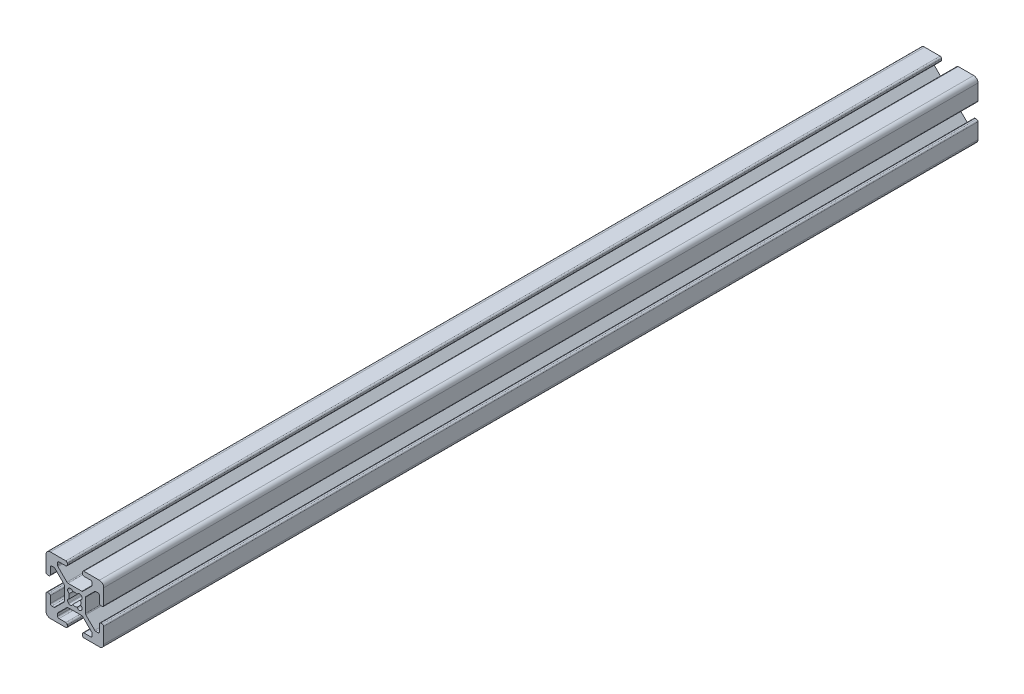
from build123d import *

# Parameters (mm, degrees)
EXTRUDE1_DEPTH = 303


with BuildPart() as part:
    # Sketch1 → Extrude1 (new body)
    with BuildSketch(Plane.XY):
        with BuildLine():
            Line((-5.032287798, -0.341059771), (-5.516287798, -0.341059771))
            ThreePointArc((-5.516287798, -0.341059771), (-5.875498042, -0.192270016), (-6.024287798, 0.166940229))
            Line((-6.024287798, 0.166940229), (-6.024287798, 2.515940229))
            ThreePointArc((-6.024287798, 2.515940229), (-6.173077553, 2.875150474), (-6.532287798, 3.023940229))
            Line((-6.532287798, 3.023940229), (-7.258207136, 3.023940229))
            ThreePointArc((-7.258207136, 3.023940229), (-7.45261032, 2.985271032), (-7.617417381, 2.875150474))
            Line((-7.617417381, 2.875150474), (-10.720498042, -0.227930187))
            ThreePointArc((-10.720498042, -0.227930187), (-10.8306186, -0.392737249), (-10.869287798, -0.587140432))
            Line((-10.869287798, -0.587140432), (-10.869287798, -5.354979109))
            ThreePointArc((-10.869287798, -5.354979109), (-10.8306186, -5.549382293), (-10.720498042, -5.714189354))
            Line((-10.720498042, -5.714189354), (-7.617417381, -8.817270016))
            ThreePointArc((-7.617417381, -8.817270016), (-7.45261032, -8.927390573), (-7.258207136, -8.966059771))
            Line((-7.258207136, -8.966059771), (-6.532287798, -8.966059771))
            ThreePointArc((-6.532287798, -8.966059771), (-6.173077553, -8.817270016), (-6.024287798, -8.458059771))
            Line((-6.024287798, -8.458059771), (-6.024287798, -6.109059771))
            ThreePointArc((-6.024287798, -6.109059771), (-5.875498042, -5.749849526), (-5.516287798, -5.601059771))
            Line((-5.516287798, -5.601059771), (-5.032287798, -5.601059771))
            ThreePointArc((-5.032287798, -5.601059771), (-4.673077553, -5.749849526), (-4.524287798, -6.109059771))
            Line((-4.524287798, -6.109059771), (-4.524287798, -11.471059771))
            ThreePointArc((-4.524287798, -11.471059771), (-4.963627626, -12.531719943), (-6.024287798, -12.971059771))
            Line((-6.024287798, -12.971059771), (-11.386287798, -12.971059771))
            ThreePointArc((-11.386287798, -12.971059771), (-11.745498042, -12.822270016), (-11.894287798, -12.463059771))
            Line((-11.894287798, -12.463059771), (-11.894287798, -11.979059771))
            ThreePointArc((-11.894287798, -11.979059771), (-11.745498042, -11.619849526), (-11.386287798, -11.471059771))
            Line((-11.386287798, -11.471059771), (-9.037287798, -11.471059771))
            ThreePointArc((-9.037287798, -11.471059771), (-8.678077553, -11.322270016), (-8.529287798, -10.963059771))
            Line((-8.529287798, -10.963059771), (-8.529287798, -10.237140432))
            ThreePointArc((-8.529287798, -10.237140432), (-8.567956995, -10.042737249), (-8.678077553, -9.877930187))
            Line((-8.678077553, -9.877930187), (-11.781158214, -6.774849526))
            ThreePointArc((-11.781158214, -6.774849526), (-11.945965275, -6.664728968), (-12.140368459, -6.626059771))
            Line((-12.140368459, -6.626059771), (-16.908207136, -6.626059771))
            ThreePointArc((-16.908207136, -6.626059771), (-17.10261032, -6.664728968), (-17.267417381, -6.774849526))
            Line((-17.267417381, -6.774849526), (-20.370498042, -9.877930187))
            ThreePointArc((-20.370498042, -9.877930187), (-20.4806186, -10.042737249), (-20.519287798, -10.237140432))
            Line((-20.519287798, -10.237140432), (-20.519287798, -10.963059771))
            ThreePointArc((-20.519287798, -10.963059771), (-20.370498042, -11.322270016), (-20.011287798, -11.471059771))
            Line((-20.011287798, -11.471059771), (-17.662287798, -11.471059771))
            ThreePointArc((-17.662287798, -11.471059771), (-17.303077553, -11.619849526), (-17.154287798, -11.979059771))
            Line((-17.154287798, -11.979059771), (-17.154287798, -12.463059771))
            ThreePointArc((-17.154287798, -12.463059771), (-17.303077553, -12.822270016), (-17.662287798, -12.971059771))
            Line((-17.662287798, -12.971059771), (-23.024287798, -12.971059771))
            ThreePointArc((-23.024287798, -12.971059771), (-24.084947969, -12.531719943), (-24.524287798, -11.471059771))
            Line((-24.524287798, -11.471059771), (-24.524287798, -6.109059771))
            ThreePointArc((-24.524287798, -6.109059771), (-24.375498042, -5.749849526), (-24.016287798, -5.601059771))
            Line((-24.016287798, -5.601059771), (-23.532287798, -5.601059771))
            ThreePointArc((-23.532287798, -5.601059771), (-23.173077553, -5.749849526), (-23.024287798, -6.109059771))
            Line((-23.024287798, -6.109059771), (-23.024287798, -8.458059771))
            ThreePointArc((-23.024287798, -8.458059771), (-22.875498042, -8.817270016), (-22.516287798, -8.966059771))
            Line((-22.516287798, -8.966059771), (-21.790368459, -8.966059771))
            ThreePointArc((-21.790368459, -8.966059771), (-21.595965275, -8.927390573), (-21.431158214, -8.817270016))
            Line((-21.431158214, -8.817270016), (-18.328077553, -5.714189354))
            ThreePointArc((-18.328077553, -5.714189354), (-18.217956995, -5.549382293), (-18.179287798, -5.354979109))
            Line((-18.179287798, -5.354979109), (-18.179287798, -0.587140432))
            ThreePointArc((-18.179287798, -0.587140432), (-18.217956995, -0.392737249), (-18.328077553, -0.227930187))
            Line((-18.328077553, -0.227930187), (-21.431158214, 2.875150474))
            ThreePointArc((-21.431158214, 2.875150474), (-21.595965275, 2.985271032), (-21.790368459, 3.023940229))
            Line((-21.790368459, 3.023940229), (-22.516287798, 3.023940229))
            ThreePointArc((-22.516287798, 3.023940229), (-22.875498042, 2.875150474), (-23.024287798, 2.515940229))
            Line((-23.024287798, 2.515940229), (-23.024287798, 0.166940229))
            ThreePointArc((-23.024287798, 0.166940229), (-23.173077553, -0.192270016), (-23.532287798, -0.341059771))
            Line((-23.532287798, -0.341059771), (-24.016287798, -0.341059771))
            ThreePointArc((-24.016287798, -0.341059771), (-24.375498042, -0.192270016), (-24.524287798, 0.166940229))
            Line((-24.524287798, 0.166940229), (-24.524287798, 5.528940229))
            ThreePointArc((-24.524287798, 5.528940229), (-24.084947969, 6.589600401), (-23.024287798, 7.028940229))
            Line((-23.024287798, 7.028940229), (-17.662287798, 7.028940229))
            ThreePointArc((-17.662287798, 7.028940229), (-17.303077553, 6.880150474), (-17.154287798, 6.520940229))
            Line((-17.154287798, 6.520940229), (-17.154287798, 6.036940229))
            ThreePointArc((-17.154287798, 6.036940229), (-17.303077553, 5.677729984), (-17.662287798, 5.528940229))
            Line((-17.662287798, 5.528940229), (-20.011287798, 5.528940229))
            ThreePointArc((-20.011287798, 5.528940229), (-20.370498042, 5.380150474), (-20.519287798, 5.020940229))
            Line((-20.519287798, 5.020940229), (-20.519287798, 4.295020891))
            ThreePointArc((-20.519287798, 4.295020891), (-20.4806186, 4.100617707), (-20.370498042, 3.935810646))
            Line((-20.370498042, 3.935810646), (-17.267417381, 0.832729984))
            ThreePointArc((-17.267417381, 0.832729984), (-17.10261032, 0.722609427), (-16.908207136, 0.683940229))
            Line((-16.908207136, 0.683940229), (-12.140368459, 0.683940229))
            ThreePointArc((-12.140368459, 0.683940229), (-11.945965275, 0.722609427), (-11.781158214, 0.832729984))
            Line((-11.781158214, 0.832729984), (-8.678077553, 3.935810646))
            ThreePointArc((-8.678077553, 3.935810646), (-8.567956995, 4.100617707), (-8.529287798, 4.295020891))
            Line((-8.529287798, 4.295020891), (-8.529287798, 5.020940229))
            ThreePointArc((-8.529287798, 5.020940229), (-8.678077553, 5.380150474), (-9.037287798, 5.528940229))
            Line((-9.037287798, 5.528940229), (-11.386287798, 5.528940229))
            ThreePointArc((-11.386287798, 5.528940229), (-11.745498042, 5.677729984), (-11.894287798, 6.036940229))
            Line((-11.894287798, 6.036940229), (-11.894287798, 6.520940229))
            ThreePointArc((-11.894287798, 6.520940229), (-11.745498042, 6.880150474), (-11.386287798, 7.028940229))
            Line((-11.386287798, 7.028940229), (-6.024287798, 7.028940229))
            ThreePointArc((-6.024287798, 7.028940229), (-4.963627626, 6.589600401), (-4.524287798, 5.528940229))
            Line((-4.524287798, 5.528940229), (-4.524287798, 0.166940229))
            ThreePointArc((-4.524287798, 0.166940229), (-4.673077553, -0.192270016), (-5.032287798, -0.341059771))
        make_face()
        with BuildLine():
            Line((-12.399386954, -5.275565737), (-12.219781831, -5.095960615))
            ThreePointArc((-12.219781831, -5.095960615), (-12.018349781, -4.327527582), (-12.589154291, -3.775036489))
            ThreePointArc((-12.589154291, -3.775036489), (-12.428787798, -2.971059771), (-12.589154291, -2.167083053))
            ThreePointArc((-12.589154291, -2.167083053), (-12.018349781, -1.61459196), (-12.219781831, -0.846158927))
            Line((-12.219781831, -0.846158927), (-12.399386954, -0.666553805))
            ThreePointArc((-12.399386954, -0.666553805), (-13.167819987, -0.465121754), (-13.72031108, -1.035926265))
            ThreePointArc((-13.72031108, -1.035926265), (-14.524287798, -0.875559771), (-15.328264516, -1.035926265))
            ThreePointArc((-15.328264516, -1.035926265), (-15.880755608, -0.465121754), (-16.649188641, -0.666553805))
            Line((-16.649188641, -0.666553805), (-16.828793764, -0.846158927))
            ThreePointArc((-16.828793764, -0.846158927), (-17.030225814, -1.61459196), (-16.459421304, -2.167083053))
            ThreePointArc((-16.459421304, -2.167083053), (-16.619787798, -2.971059771), (-16.459421304, -3.775036489))
            ThreePointArc((-16.459421304, -3.775036489), (-17.030225814, -4.327527582), (-16.828793764, -5.095960615))
            Line((-16.828793764, -5.095960615), (-16.649188641, -5.275565737))
            ThreePointArc((-16.649188641, -5.275565737), (-15.880755608, -5.476997788), (-15.328264516, -4.906193277))
            ThreePointArc((-15.328264516, -4.906193277), (-14.524287798, -5.066559771), (-13.72031108, -4.906193277))
            ThreePointArc((-13.72031108, -4.906193277), (-13.167819987, -5.476997788), (-12.399386954, -5.275565737))
        make_face(mode=Mode.SUBTRACT)
    extrude(amount=EXTRUDE1_DEPTH)


solid = part.part
